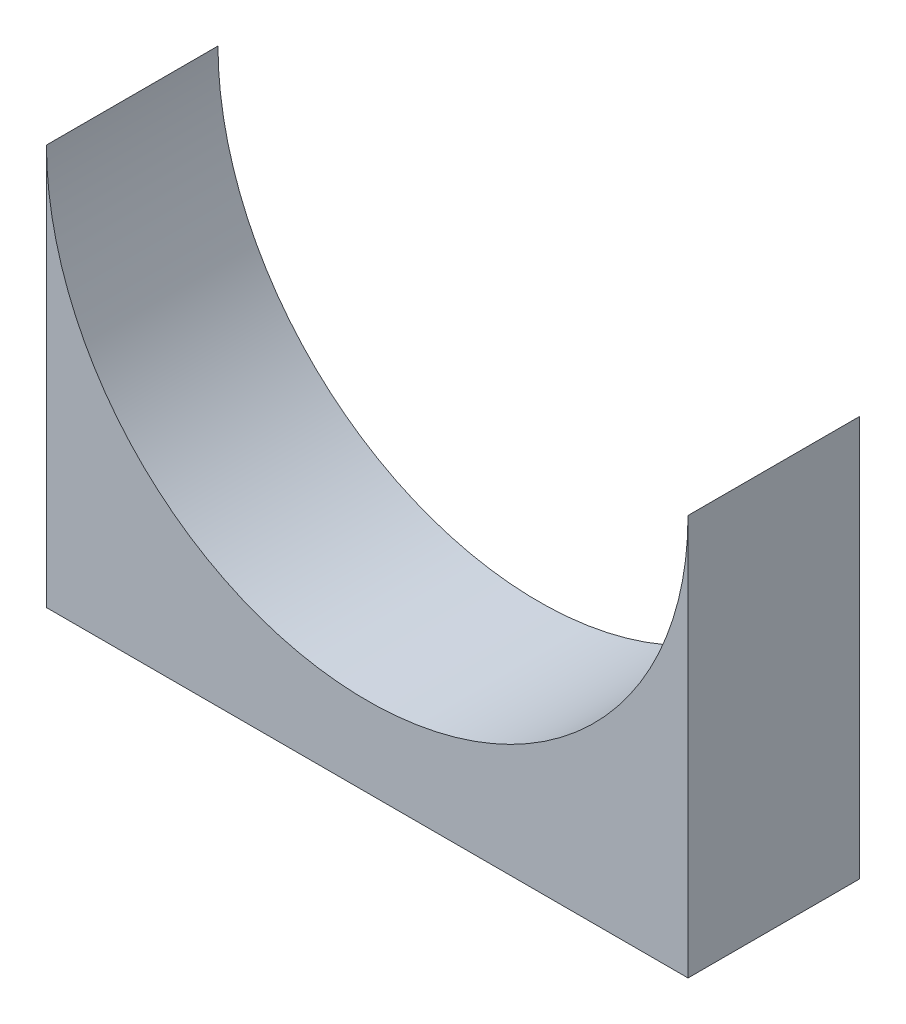
from build123d import *

# Parameters (mm, degrees)
BOSS_EXTRUDE1_DEPTH = 10


with BuildPart() as part:
    # Sketch1 → Boss-Extrude1 (new body)
    with BuildSketch(Plane.XY):
        with BuildLine():
            Line((-18.7, 11.674864865), (-18.7, -11.674864865))
            Line((-18.7, -11.674864865), (18.7, -11.674864865))
            Line((18.7, -11.674864865), (18.7, 11.674864865))
            ThreePointArc((18.7, 11.674864865), (0, -7.025135135), (-18.7, 11.674864865))
        make_face()
    extrude(amount=BOSS_EXTRUDE1_DEPTH)


solid = part.part
